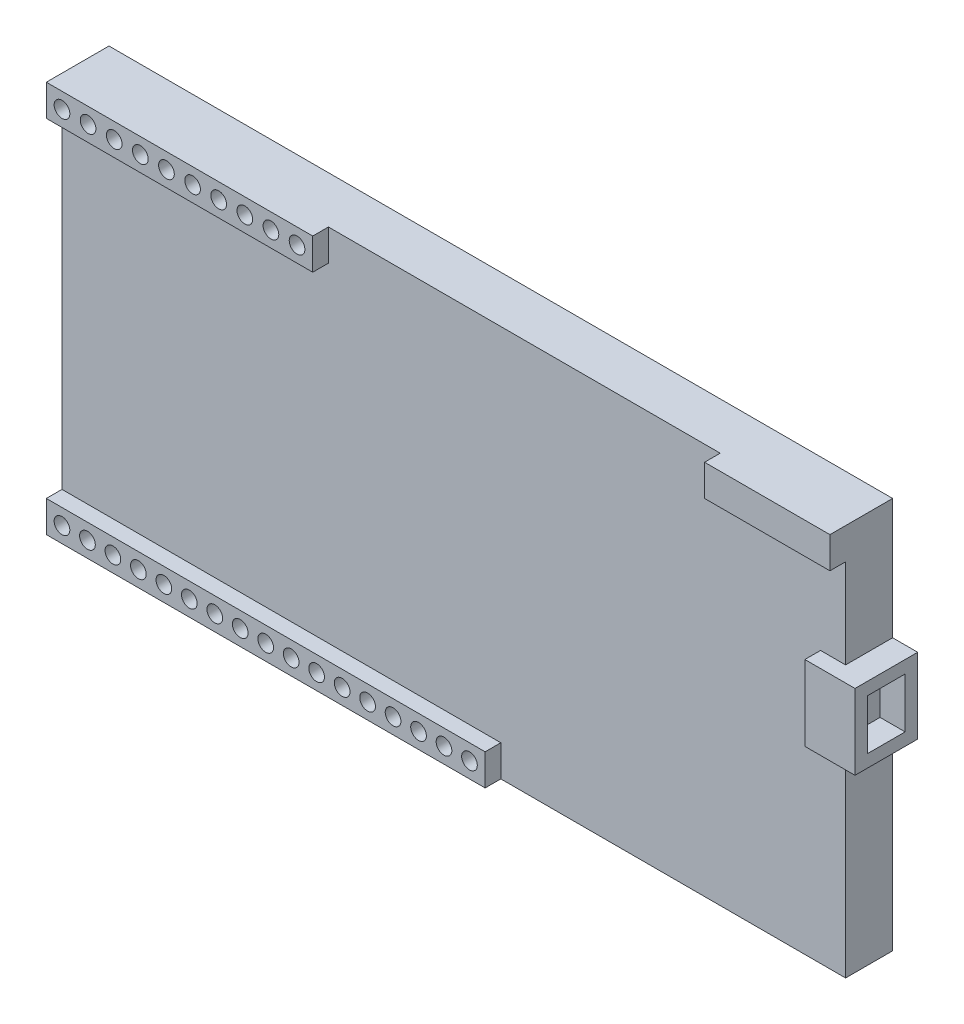
from build123d import *

# Parameters (mm, degrees)
SKETCH1_W           = 125
SKETCH1_H           = 250
BOSS_EXTRUDE1_DEPTH = 15
SKETCH2_W           = 85
SKETCH2_H           = 10
SKETCH2_R           = 2.5
SKETCH2_W_2         = 140
SKETCH2_W_3         = 40
BOSS_EXTRUDE2_DEPTH = 5
SKETCH3_W           = 24
SKETCH3_H           = 20
SKETCH3_W_2         = 16
SKETCH3_H_2         = 12
BOSS_EXTRUDE3_DEPTH = 8
SKETCH4_W           = 24
SKETCH4_H           = 20
BOSS_EXTRUDE4_DEPTH = 8


with BuildPart() as part:
    # Sketch1 → Boss-Extrude1 (new body)
    with BuildSketch(Plane(origin=(0, 0, 0), x_dir=(0, 1, 0), z_dir=(0, 0, 1))):
        Rectangle(SKETCH1_W, SKETCH1_H)
    extrude(amount=BOSS_EXTRUDE1_DEPTH)

    # Sketch2 → Boss-Extrude2 (add)
    # profile 1 of 3: a face of its own
    with BuildSketch(Plane.XY.offset(15)):
        with Locations((-82.5, 57.5)):
            Rectangle(SKETCH2_W, SKETCH2_H)
        with Locations((-120, 57.5)):
            Circle(SKETCH2_R, mode=Mode.SUBTRACT)
        with Locations((-111.666666667, 57.5)):
            Circle(SKETCH2_R, mode=Mode.SUBTRACT)
        with Locations((-103.333333333, 57.5)):
            Circle(SKETCH2_R, mode=Mode.SUBTRACT)
        with Locations((-95, 57.5)):
            Circle(SKETCH2_R, mode=Mode.SUBTRACT)
        with Locations((-86.666666667, 57.5)):
            Circle(SKETCH2_R, mode=Mode.SUBTRACT)
        with Locations((-78.333333333, 57.5)):
            Circle(SKETCH2_R, mode=Mode.SUBTRACT)
        with Locations((-70, 57.5)):
            Circle(SKETCH2_R, mode=Mode.SUBTRACT)
        with Locations((-61.666666667, 57.5)):
            Circle(SKETCH2_R, mode=Mode.SUBTRACT)
        with Locations((-53.333333333, 57.5)):
            Circle(SKETCH2_R, mode=Mode.SUBTRACT)
        with Locations((-45, 57.5)):
            Circle(SKETCH2_R, mode=Mode.SUBTRACT)
    # profile 2 of 3: a face of its own
    with BuildSketch(Plane.XY.offset(15)):
        with Locations((-55, -57.5)):
            Rectangle(SKETCH2_W_2, SKETCH2_H)
        with Locations((-120, -57.5)):
            Circle(SKETCH2_R, mode=Mode.SUBTRACT)
        with Locations((-111.875, -57.5)):
            Circle(SKETCH2_R, mode=Mode.SUBTRACT)
        with Locations((-103.75, -57.5)):
            Circle(SKETCH2_R, mode=Mode.SUBTRACT)
        with Locations((-95.625, -57.5)):
            Circle(SKETCH2_R, mode=Mode.SUBTRACT)
        with Locations((-87.5, -57.5)):
            Circle(SKETCH2_R, mode=Mode.SUBTRACT)
        with Locations((-79.375, -57.5)):
            Circle(SKETCH2_R, mode=Mode.SUBTRACT)
        with Locations((-71.25, -57.5)):
            Circle(SKETCH2_R, mode=Mode.SUBTRACT)
        with Locations((-63.125, -57.5)):
            Circle(SKETCH2_R, mode=Mode.SUBTRACT)
        with Locations((-55, -57.5)):
            Circle(SKETCH2_R, mode=Mode.SUBTRACT)
        with Locations((-46.875, -57.5)):
            Circle(SKETCH2_R, mode=Mode.SUBTRACT)
        with Locations((-38.75, -57.5)):
            Circle(SKETCH2_R, mode=Mode.SUBTRACT)
        with Locations((-30.625, -57.5)):
            Circle(SKETCH2_R, mode=Mode.SUBTRACT)
        with Locations((-22.5, -57.5)):
            Circle(SKETCH2_R, mode=Mode.SUBTRACT)
        with Locations((-14.375, -57.5)):
            Circle(SKETCH2_R, mode=Mode.SUBTRACT)
        with Locations((-6.25, -57.5)):
            Circle(SKETCH2_R, mode=Mode.SUBTRACT)
        with Locations((1.875, -57.5)):
            Circle(SKETCH2_R, mode=Mode.SUBTRACT)
        with Locations((10, -57.5)):
            Circle(SKETCH2_R, mode=Mode.SUBTRACT)
    # profile 3 of 3: a face of its own
    with BuildSketch(Plane.XY.offset(15)):
        with Locations((105, 57.5)):
            Rectangle(SKETCH2_W_3, SKETCH2_H)
    extrude(amount=BOSS_EXTRUDE2_DEPTH)

    # Sketch3 → Boss-Extrude3 (add)
    with BuildSketch(Plane.YZ.offset(125)):
        with Locations((12, 10)):
            Rectangle(SKETCH3_W, SKETCH3_H)
        with Locations((12, 10)):
            Rectangle(SKETCH3_W_2, SKETCH3_H_2, mode=Mode.SUBTRACT)
    extrude(amount=BOSS_EXTRUDE3_DEPTH)

    # Sketch4 → Boss-Extrude4 (add)
    with BuildSketch(Plane(origin=(125, 0, 0), x_dir=(0, -1, 0), z_dir=(-1, 0, 0))):
        with Locations((-12, 10)):
            Rectangle(SKETCH4_W, SKETCH4_H)
    extrude(amount=BOSS_EXTRUDE4_DEPTH)


solid = part.part
